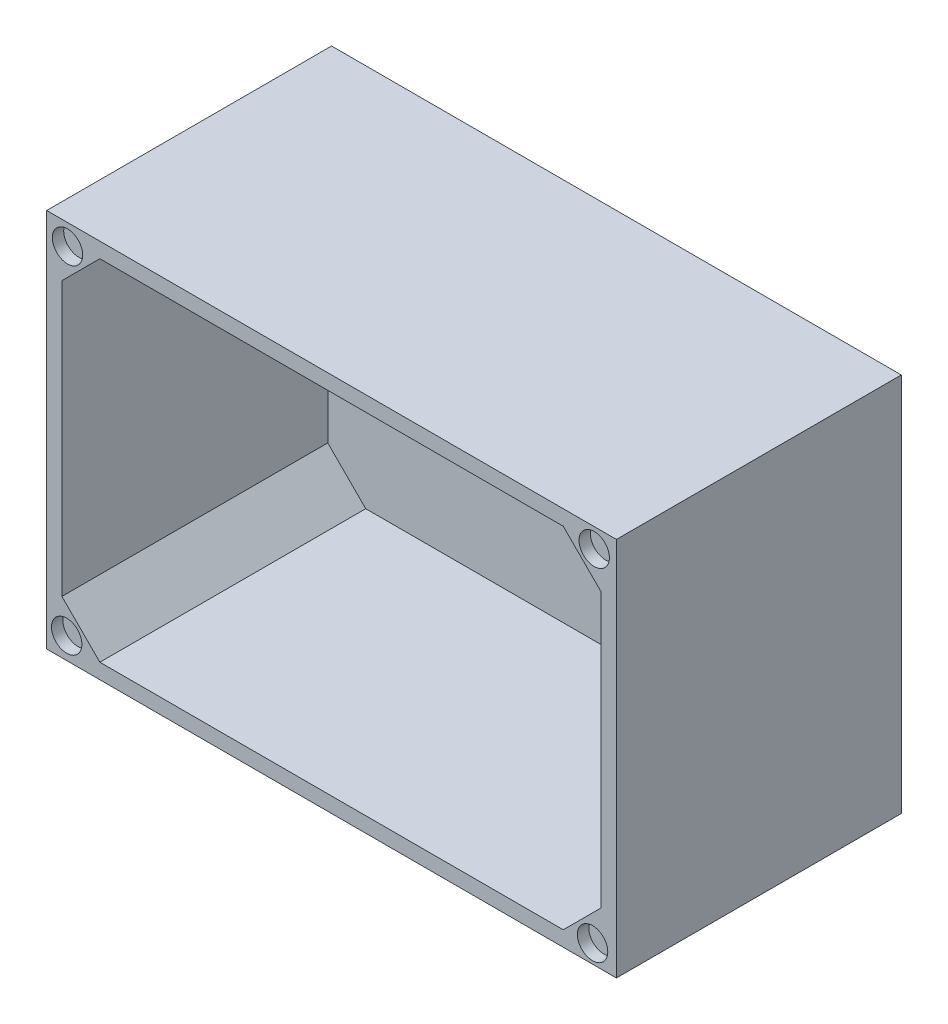
from build123d import *

# Parameters (mm, degrees)
ESQUISSE1_W             = 150
ESQUISSE1_H             = 100
BOSS_EXTRU_1_DEPTH      = 75
ENL_V_MAT_EXTRU_2_DEPTH = 70
ESQUISSE5_R             = 4
ENL_V_MAT_EXTRU_3_DEPTH = 3
ESQUISSE6_R             = 4
ENL_V_MAT_EXTRU_4_DEPTH = 3


with BuildPart() as part:
    # Esquisse1 → Boss.-Extru.1 (new body)
    with BuildSketch(Plane.XY):
        with Locations((23.806447762, -50)):
            Rectangle(ESQUISSE1_W, ESQUISSE1_H)
    extrude(amount=BOSS_EXTRU_1_DEPTH)

    # Esquisse2 → Enlèv. mat.-Extru.2 (cut)
    with BuildSketch(Plane.XY.offset(75)):
        Polygon((-37.193552238, -4), (84.806447762, -4), (94.806447762, -14), (94.806447762, -86), (84.806447762, -96), (-37.193552238, -96), (-47.193552238, -86), (-47.193552238, -14), align=None)
    extrude(amount=-ENL_V_MAT_EXTRU_2_DEPTH, mode=Mode.SUBTRACT)

    # Esquisse5 → Enlèv. mat.-Extru.3 (cut)
    with BuildSketch(Plane.XY.offset(75)):
        with Locations((-45.7114952, -5.446962242)):
            Circle(ESQUISSE5_R)
    extrude(amount=-ENL_V_MAT_EXTRU_3_DEPTH, mode=Mode.SUBTRACT)

    # Esquisse6 → Enlèv. mat.-Extru.4 (cut)
    with BuildSketch(Plane.XY.offset(75)):
        with Locations((92.954779507, -5.115671586)):
            Circle(ESQUISSE6_R)
        with Locations((92.526014057, -95.195707231)):
            Circle(ESQUISSE6_R)
        with Locations((-45.931001662, -94.321365955)):
            Circle(ESQUISSE6_R)
    extrude(amount=-ENL_V_MAT_EXTRU_4_DEPTH, mode=Mode.SUBTRACT)


solid = part.part
